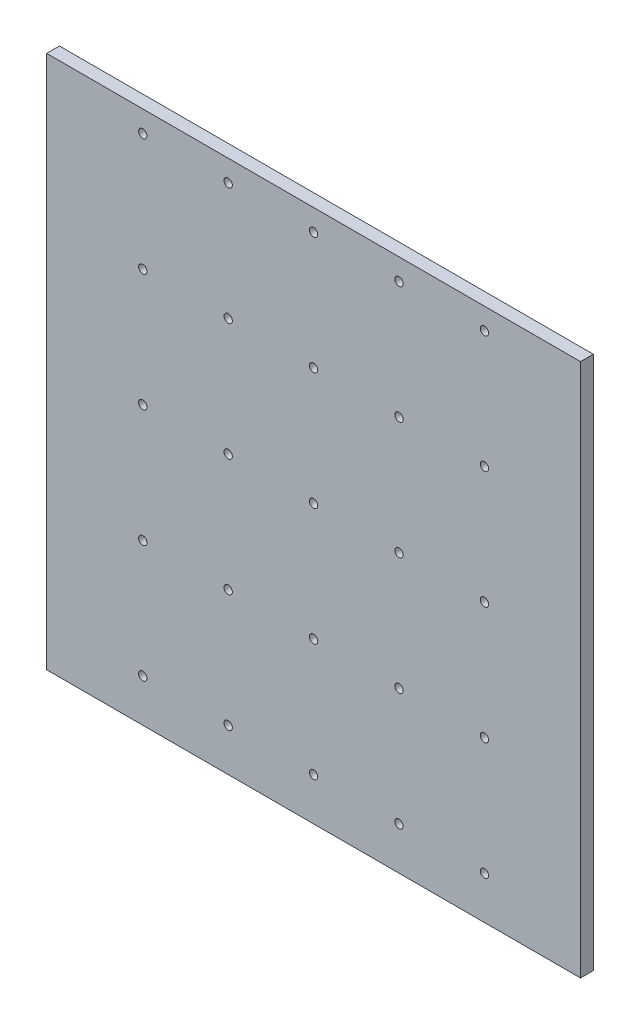
from build123d import *

# Parameters (mm, degrees)
ESQUISSE1_W                       = 250
ESQUISSE1_H                       = 250
BOSS_EXTRU_1_DEPTH                = 6
DIAM_TRE_DU_PER_AGE_0_15_0_15_1_D = 3.9
R_P_TITION_LIN_AIRE1_COUNT        = 4
R_P_TITION_LIN_AIRE1_PITCH        = 40
R_P_TITION_LIN_AIRE1_COUNT_DIR2   = 5
R_P_TITION_LIN_AIRE1_PITCH_DIR2   = 55
R_P_TITION_LIN_AIRE2_COUNT        = 2
R_P_TITION_LIN_AIRE2_PITCH        = 40
R_P_TITION_LIN_AIRE2_COUNT_DIR2   = 5
R_P_TITION_LIN_AIRE2_PITCH_DIR2   = 55


with BuildPart() as part:
    # Esquisse1 → Boss.-Extru.1 (new body)
    with BuildSketch(Plane.XY):
        with Locations((125, 125)):
            Rectangle(ESQUISSE1_W, ESQUISSE1_H)
    extrude(amount=BOSS_EXTRU_1_DEPTH)

    # Diamètre du perçage Ø0.15 (0.15)1 (through all)
    with Locations(Plane.XY.offset(6)):
        with Locations((85, 20)):
            diam_tre_du_per_age_0_15_0_15_1 = Hole(DIAM_TRE_DU_PER_AGE_0_15_0_15_1_D / 2)

    # Répétition linéaire1: Diam_tre du per_age _0.15 _0.15_1 4 × 5
    with Locations(*[(i * R_P_TITION_LIN_AIRE1_PITCH, j * R_P_TITION_LIN_AIRE1_PITCH_DIR2, 0) for i in range(R_P_TITION_LIN_AIRE1_COUNT) for j in range(R_P_TITION_LIN_AIRE1_COUNT_DIR2) if (i, j) != (0, 0)]):
        add(diam_tre_du_per_age_0_15_0_15_1, mode=Mode.SUBTRACT)

    # Répétition linéaire2: Diam_tre du per_age _0.15 _0.15_1 2 × 5
    with Locations(*[(-i * R_P_TITION_LIN_AIRE2_PITCH, j * R_P_TITION_LIN_AIRE2_PITCH_DIR2, 0) for i in range(R_P_TITION_LIN_AIRE2_COUNT) for j in range(R_P_TITION_LIN_AIRE2_COUNT_DIR2) if (i, j) != (0, 0)]):
        add(diam_tre_du_per_age_0_15_0_15_1, mode=Mode.SUBTRACT)


solid = part.part
